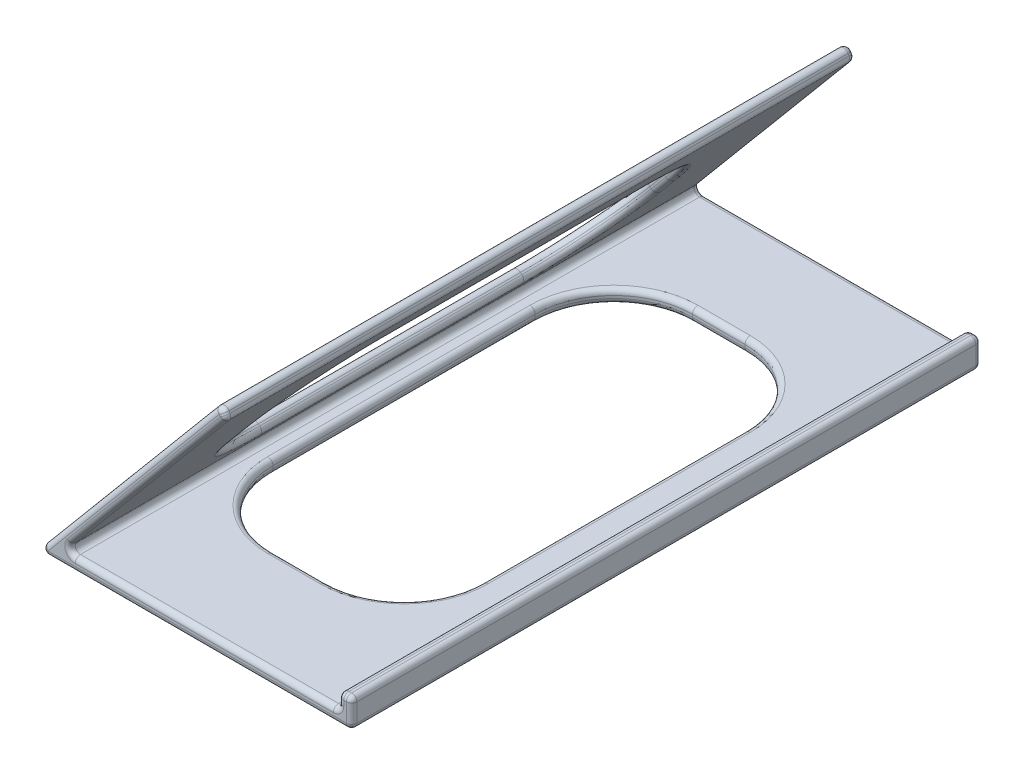
from build123d import *

# Parameters (mm, degrees)
BOSS_EXTRUDE2_DEPTH     = 152.4
CUT_EXTRUDE2_DEPTH      = 179.396261808
CUT_EXTRUDE2_DEPTH_BACK = 3.175
SKETCH3_W               = 50.8
SKETCH3_H               = 101.6
SKETCH4_W               = 101.6
SKETCH4_H               = 43.589586251
CUT_EXTRUDE3_DEPTH      = 2.983524071
FILLET1_R               = 19.05
FILLET2_R               = 19.05
FILLET3_R               = 1.27


with BuildPart() as part:
    # Sketch2 → Boss-Extrude2 (new body)
    with BuildSketch(Plane.XY):
        Polygon((0, 0), (-76.2, 0), (-31.85434876, 52.849089181), (-30.26684876, 50.099458524), (-69.641144601, 3.175), (-3.175, 3.175), (-3.175, 6.985), (0, 6.985), (0, 3.175), align=None)
    extrude(amount=BOSS_EXTRUDE2_DEPTH)

    # Sketch3 → Cut-Extrude2 (cut, two sides: drawn at the far end of the back side and taken through both)
    with BuildSketch(Plane(origin=(0, 0, 0), x_dir=(-1, 0, 0), z_dir=(0, -1, 0)).offset(-CUT_EXTRUDE2_DEPTH_BACK)):
        with Locations((38.1, -76.2)):
            Rectangle(SKETCH3_W, SKETCH3_H)
    extrude(amount=CUT_EXTRUDE2_DEPTH + CUT_EXTRUDE2_DEPTH_BACK, mode=Mode.SUBTRACT)

    # Sketch4 → Cut-Extrude3 (cut)
    with BuildSketch(Plane(origin=(-44.715995569, 37.52117539, 0), x_dir=(0, 0, 1), z_dir=(-0.7660444431189749, 0.6427876096865432, 0))):
        with Locations((76.2, -14.485622733)):
            Rectangle(SKETCH4_W, SKETCH4_H)
    extrude(amount=-CUT_EXTRUDE3_DEPTH, mode=Mode.SUBTRACT)

    # Fillet1
    fillet1_edges = [part.edges().sort_by_distance(p)[0] for p in [
        (-66.893841339, 8.769878275, 25.4),
        (-66.893841339, 8.769878275, 127),
        (-38.874995386, 42.1614386, 127),
        (-38.874995386, 42.1614386, 25.4),
    ]]
    fillet(fillet1_edges, radius=FILLET1_R)

    # Fillet2
    fillet2_edges = [part.edges().sort_by_distance(p)[0] for p in [
        (-12.7, 1.5875, 127),
        (-12.7, 1.5875, 25.4),
        (-63.5, 1.5875, 25.4),
        (-63.5, 1.5875, 127),
    ]]
    fillet(fillet2_edges, radius=FILLET2_R)

    # Fillet3
    fillet3_edges = [part.edges().sort_by_distance(p)[0] for p in [
        (-38.1, 3.175, 127),
        (-38.1, 0, 127),
        (-12.7, 3.175, 76.2),
        (-31.06059876, 51.474273852, 0),
        (-12.7, 0, 76.2),
        (-38.1, 3.175, 25.4),
        (-38.1, 0, 25.4),
        (-49.953996681, 26.637229262, 0),
        (-63.5, 3.175, 76.2),
        (-63.5, 0, 76.2),
        (-18.279615818, 0, 121.420384182),
        (-18.279615818, 3.175, 121.420384182),
        (-18.279615818, 0, 30.979615818),
        (-36.4080723, 3.175, 0),
        (-18.279615818, 3.175, 30.979615818),
        (-57.920384182, 0, 121.420384182),
        (-57.920384182, 3.175, 121.420384182),
        (-57.920384182, 0, 30.979615818),
        (-57.920384182, 3.175, 30.979615818),
        (-3.175, 5.08, 0),
        (-1.5875, 6.985, 0),
        (0, 3.4925, 0),
        (-1.5875, 6.985, 152.4),
        (0, 0, 76.2),
        (-76.2, 0, 76.2),
        (-31.85434876, 52.849089181, 76.2),
        (-30.26684876, 50.099458524, 76.2),
        (-69.641144601, 3.175, 76.2),
        (-3.175, 3.175, 76.2),
        (-3.175, 6.985, 76.2),
        (0, 6.985, 76.2),
        (-3.175, 5.08, 152.4),
        (-36.4080723, 3.175, 152.4),
        (-49.953996681, 26.637229262, 152.4),
        (-31.06059876, 51.474273852, 152.4),
        (-54.02717438, 26.42454459, 152.4),
        (-38.1, 0, 152.4),
        (0, 3.4925, 152.4),
        (-68.036597357, 9.728764428, 76.2),
        (-65.751085321, 7.810992122, 76.2),
        (-54.02717438, 26.42454459, 25.4),
        (-51.741662345, 24.506772284, 25.4),
        (-51.741662345, 24.506772284, 127),
        (-54.02717438, 26.42454459, 127),
        (-37.732239368, 41.202552447, 76.2),
        (-40.017751403, 43.120324753, 76.2),
        (-64.450089442, 14.00299812, 30.979615818),
        (-62.164577407, 12.085225814, 30.979615818),
        (-64.450089442, 14.00299812, 121.420384182),
        (-62.164577407, 12.085225814, 121.420384182),
        (-43.604259318, 38.846091061, 121.420384182),
        (-41.318747283, 36.928318755, 121.420384182),
        (-43.604259318, 38.846091061, 30.979615818),
        (-41.318747283, 36.928318755, 30.979615818),
        (-38.1, 0, 0),
        (-54.02717438, 26.42454459, 0),
    ]]
    fillet(fillet3_edges, radius=FILLET3_R)


solid = part.part
